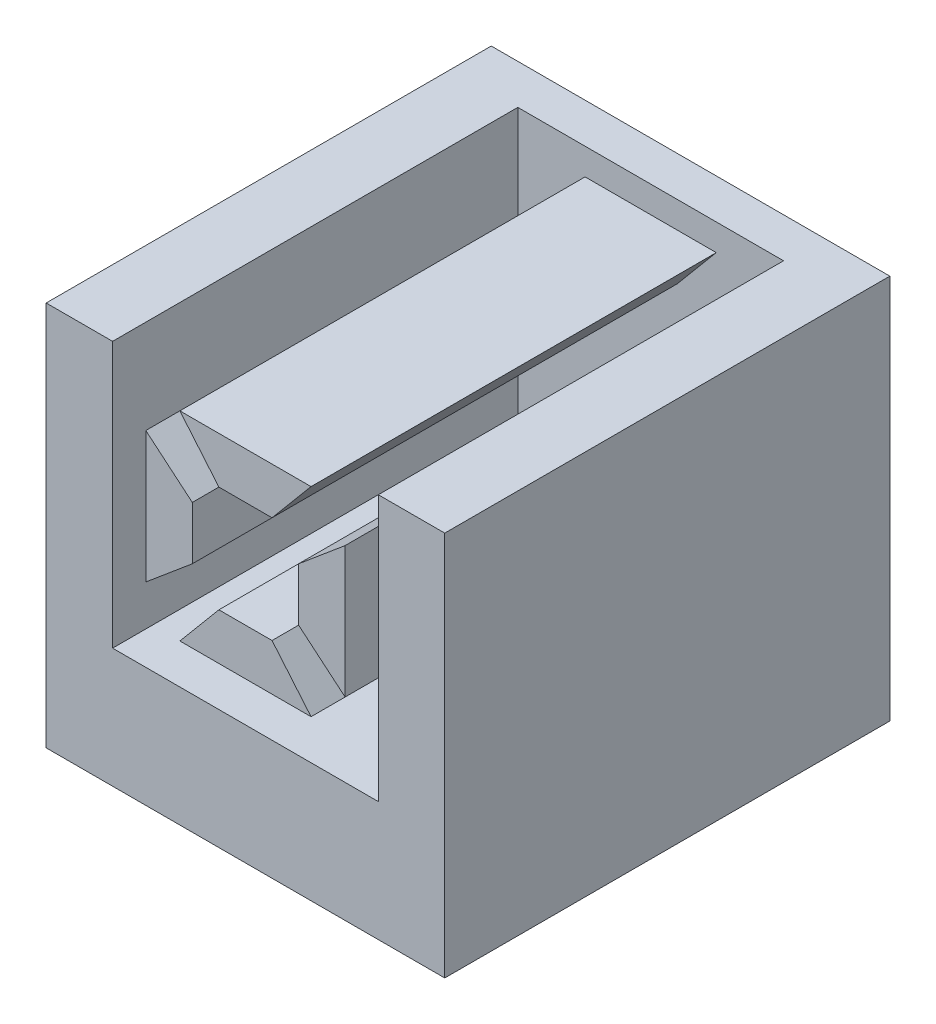
from build123d import *

# Parameters (mm, degrees)
BOSS_EXTRUDE2_DEPTH          = 8
BOSS_EXTRUDE2_DEPTH_BACK     = 1
SKETCH1_R                    = 2.5
CUT_EXTRUDE1_DEPTH           = 79.300702423
CUT_EXTRUDE1_DEPTH_BACK      = 79.300702423
SKETCH2_R                    = 2.5
SKETCH3_R                    = 3.25
CUT_EXTRUDE5_DEPTH           = 15
CUT_EXTRUDE5_DRAFT           = -0.0573
CUT_EXTRUDE5_PROFILE_2_DEPTH = 15
CUT_EXTRUDE5_PROFILE_2_DRAFT = -0.0573
SKETCH5_W                    = 4.5
SKETCH5_H                    = 6.5
BOSS_EXTRUDE3_DEPTH          = 14.5
SKETCH6_R                    = 4
CUT_EXTRUDE4_DEPTH           = 1.5
SKETCH12_W                   = 10.5
SKETCH12_H                   = 30
BOSS_EXTRUDE7_DEPTH          = 9
SKETCH15_W                   = 9
SKETCH15_H                   = 6.5
BOSS_EXTRUDE8_DEPTH          = 3.5
BOSS_EXTRUDE9_DEPTH          = 54
FILLET4_R                    = 5
SKETCH18_W                   = 9.873697418
SKETCH18_H                   = 6.5
BOSS_EXTRUDE11_DEPTH         = 0.5
SKETCH20_W                   = 4
SKETCH20_H                   = 17.5
BOSS_EXTRUDE12_DEPTH         = 18
BOSS_EXTRUDE13_DEPTH         = 11
BOSS_EXTRUDE13_DEPTH_BACK    = 4
SKETCH22_W                   = 17.5
SKETCH22_H                   = 4
SKETCH25_W                   = 2
SKETCH25_H                   = 17.5
BOSS_EXTRUDE14_DEPTH         = 41
SKETCH28_W                   = 41
SKETCH28_H                   = 45
BOSS_EXTRUDE15_DEPTH         = 2
SKETCH29_R                   = 1.75
CUT_EXTRUDE8_DEPTH           = 9
BOSS_EXTRUDE16_DEPTH         = 9
BOSS_EXTRUDE16_DEPTH_BACK    = 4
SKETCH30_W                   = 17.5
SKETCH30_H                   = 2
CUT_EXTRUDE9_DEPTH           = 9
SKETCH32_W                   = 13
SKETCH32_H                   = 4
BOSS_EXTRUDE17_DEPTH         = 23.5
SKETCH33_W                   = 0.5
SKETCH33_H                   = 17.5
BOSS_EXTRUDE18_DEPTH         = 20
SKETCH34_W                   = 4.5
SKETCH34_H                   = 25
SKETCH34_W_2                 = 15.5
SKETCH34_H_2                 = 4
SKETCH34_W_3                 = 9
BOSS_EXTRUDE19_DEPTH         = 26
SKETCH35_W                   = 9.873697418
SKETCH35_H                   = 0.5
BOSS_EXTRUDE20_DEPTH         = 47.5
BOSS_EXTRUDE21_DEPTH         = 47.5
SKETCH38_W                   = 0.419549816
SKETCH38_H                   = 18.5
CUT_EXTRUDE10_DEPTH          = 90.5
SKETCH39_W                   = 4
SKETCH39_H                   = 4
BOSS_EXTRUDE23_DEPTH         = 47.5
SKETCH46_W                   = 22.5
SKETCH46_H                   = 9
SKETCH46_W_2                 = 5
BOSS_EXTRUDE26_DEPTH         = 11.5
SKETCH47_W                   = 27.5
SKETCH47_H                   = 9
BOSS_EXTRUDE27_DEPTH         = 11
SKETCH48_W                   = 5
SKETCH48_H                   = 6.5
BOSS_EXTRUDE31_DEPTH         = 18.5
SKETCH50_R                   = 4
CUT_EXTRUDE11_DEPTH          = 1.5
SKETCH51_W                   = 9.626242636
SKETCH51_H                   = 9.125298808
BOSS_EXTRUDE32_DEPTH         = 1.5
BOSS_EXTRUDE35_DEPTH         = 47.5
SKETCH55_W                   = 9.873697418
SKETCH55_H                   = 0.5
CUT_EXTRUDE12_DEPTH          = 47.5
SKETCH56_W                   = 0.5
SKETCH56_H                   = 20
BOSS_EXTRUDE36_DEPTH         = 43.5
BOSS_EXTRUDE37_DEPTH         = 47.5
SKETCH58_W                   = 0.715052156
SKETCH58_H                   = 9.51279705
CUT_EXTRUDE13_DEPTH          = 4
CUT_EXTRUDE15_DEPTH          = 47.5
SKETCH60_W                   = 0.215052156
SKETCH60_H                   = 9.51279705
CUT_EXTRUDE16_DEPTH          = 47.5
CUT_EXTRUDE17_DEPTH          = 47.5
SKETCH62_W                   = 8
SKETCH62_H                   = 8
CUT_EXTRUDE18_DEPTH          = 47.5
SKETCH63_W                   = 13
SKETCH63_H                   = 4
CUT_EXTRUDE20_DEPTH          = 17
SKETCH64_W                   = 1
SKETCH64_H                   = 1.5
BOSS_EXTRUDE38_DEPTH         = 6.5
SKETCH65_W                   = 7
SKETCH65_H                   = 3
CUT_EXTRUDE21_DEPTH          = 1.5
BOSS_EXTRUDE39_START         = -2
BOSS_EXTRUDE39_DEPTH         = 2
CUT_EXTRUDE22_DEPTH          = 155
CUT_EXTRUDE24_DEPTH          = 100.318930723
CUT_EXTRUDE24_DEPTH_BACK     = 100.318930723
SKETCH71_R                   = 1.75
SKETCH71_R_2                 = 12.5
SKETCH71_W                   = 8.630690043
SKETCH71_H                   = 4
CUT_EXTRUDE25_DEPTH          = 10
CUT_EXTRUDE26_DEPTH          = 78.879714946
CUT_EXTRUDE26_DEPTH_BACK     = 78.879714946
SKETCH72_W                   = 11
SKETCH72_H                   = 4
SKETCH72_W_2                 = 23.5
SKETCH72_H_2                 = 9
SKETCH72_W_3                 = 9
SKETCH72_H_3                 = 16
SKETCH72_W_4                 = 7
SKETCH72_H_4                 = 1.5
BOSS_EXTRUDE40_DEPTH         = 3
CUT_EXTRUDE27_DEPTH          = 49
SKETCH75_W                   = 30
SKETCH75_H                   = 29
BOSS_EXTRUDE41_DEPTH         = 3
BOSS_EXTRUDE42_DEPTH         = 1


with BuildPart() as part:
    # Sketch1 → Boss-Extrude2 (new, two sides: drawn at the far end of the back side and taken through both)
    with BuildSketch(Plane(origin=(0, 0, 0), x_dir=(1, 0, 0), z_dir=(0, 1, 0)).offset(-BOSS_EXTRUDE2_DEPTH_BACK)):
        with BuildLine():
            Line((5, 0), (50, 0))
            ThreePointArc((50, 0), (53.535533906, 1.464466094), (55, 5))
            Line((55, 5), (55, 50))
            ThreePointArc((55, 50), (53.535533906, 53.535533906), (50, 55))
            Line((50, 55), (5, 55))
            ThreePointArc((5, 55), (1.464466094, 53.535533906), (0, 50))
            Line((0, 50), (0, 5))
            ThreePointArc((0, 5), (1.464466094, 1.464466094), (5, 0))
        make_face()
        with Locations(Location((7.5, 47.5, 0), (0, 0, 270))):
            Circle(SKETCH1_R, mode=Mode.SUBTRACT)
        with Locations(Location((47.5, 47.5, 0), (0, 0, 270))):
            Circle(SKETCH1_R, mode=Mode.SUBTRACT)
        with Locations(Location((47.5, 7.5, 0), (0, 0, 270))):
            Circle(SKETCH1_R, mode=Mode.SUBTRACT)
        with Locations(Location((7.5, 7.5, 0), (0, 0, 270))):
            Circle(SKETCH1_R, mode=Mode.SUBTRACT)
    extrude(amount=BOSS_EXTRUDE2_DEPTH + BOSS_EXTRUDE2_DEPTH_BACK)

    # Sketch2 → Cut-Extrude1 (cut, two sides: drawn at the far end of the back side and taken through both)
    with BuildSketch(Plane(origin=(0, 8, 0), x_dir=(1, 0, 0), z_dir=(0, 1, 0)).offset(-CUT_EXTRUDE1_DEPTH_BACK)):
        with BuildLine():
            Line((0, 50), (0, 27.5))
            Line((0, 27.5), (55, 27.5))
            Line((55, 27.5), (55, 50))
            ThreePointArc((55, 50), (53.535533906, 53.535533906), (50, 55))
            Line((50, 55), (5, 55))
            ThreePointArc((5, 55), (1.464466094, 53.535533906), (0, 50))
        make_face()
        with Locations((7.5, 47.5)):
            Circle(SKETCH2_R, mode=Mode.SUBTRACT)
        with Locations((47.5, 47.5)):
            Circle(SKETCH2_R, mode=Mode.SUBTRACT)
    extrude(amount=CUT_EXTRUDE1_DEPTH + CUT_EXTRUDE1_DEPTH_BACK, mode=Mode.SUBTRACT)


with BuildPart() as cut_extrude5_tool:
    # Sketch3 → Cut-Extrude5 (with draft: the straight prism first)
    with BuildSketch(Plane(origin=(0, 0, -27.5), x_dir=(-1, 0, 0), z_dir=(0, 0, -1))):
        with Locations((-37.5, 3.5)):
            Circle(SKETCH3_R)
    extrude(amount=-CUT_EXTRUDE5_DEPTH)
    # Cut-Extrude5: the draft: its side faces are tilted about the plane it starts from
    cut_extrude5_sides = [cut_extrude5_tool.faces().sort_by_distance(p)[0] for p in [
        (40.75, 3.5, -20),
    ]]
    draft(cut_extrude5_sides, Plane(origin=(0, 0, -27.5), x_dir=(-1, 0, 0), z_dir=(0, 0, -1)), CUT_EXTRUDE5_DRAFT)


with BuildPart() as part_1:
    add(part.part)

    # Cut-Extrude5: cut by cut_extrude5_tool
    add(cut_extrude5_tool.part, mode=Mode.SUBTRACT)


with BuildPart() as cut_extrude5_profile_2_tool:
    # Sketch3 → Cut-Extrude5 profile 2 (with draft: the straight prism first)
    with BuildSketch(Plane(origin=(0, 0, -27.5), x_dir=(-1, 0, 0), z_dir=(0, 0, -1))):
        with Locations((-17.5, 3.5)):
            Circle(SKETCH3_R)
    extrude(amount=-CUT_EXTRUDE5_PROFILE_2_DEPTH)
    # Cut-Extrude5 profile 2: the draft: its side faces are tilted about the plane it starts from
    cut_extrude5_profile_2_sides = [cut_extrude5_profile_2_tool.faces().sort_by_distance(p)[0] for p in [
        (20.75, 3.5, -20),
    ]]
    draft(cut_extrude5_profile_2_sides, Plane(origin=(0, 0, -27.5), x_dir=(-1, 0, 0), z_dir=(0, 0, -1)), CUT_EXTRUDE5_PROFILE_2_DRAFT)


with BuildPart() as part_2:
    add(part_1.part)

    # Cut-Extrude5 profile 2: cut by cut_extrude5_profile_2_tool
    add(cut_extrude5_profile_2_tool.part, mode=Mode.SUBTRACT)

    # Sketch5 → Boss-Extrude3 (add)
    with BuildSketch(Plane(origin=(0, 8, 0), x_dir=(1, 0, 0), z_dir=(0, 1, 0))):
        with Locations((25.25, 20.75)):
            Rectangle(SKETCH5_W, SKETCH5_H)
        with Locations((29.75, 20.75)):
            Rectangle(SKETCH5_W, SKETCH5_H)
    extrude(amount=BOSS_EXTRUDE3_DEPTH)

    # Sketch6 → Cut-Extrude4 (cut)
    with BuildSketch(Plane(origin=(0, 0, -24), x_dir=(-1, 0, 0), z_dir=(0, 0, -1))):
        with Locations((-27.5, 17)):
            Circle(SKETCH6_R)
    extrude(amount=-CUT_EXTRUDE4_DEPTH, mode=Mode.SUBTRACT)

    # Sketch12 → Boss-Extrude7 (add)
    with BuildSketch(Plane(origin=(0, 8, 0), x_dir=(1, 0, 0), z_dir=(0, 1, 0))):
        with Locations((32.75, -15)):
            Rectangle(SKETCH12_W, SKETCH12_H)
        with Locations((22.25, -15)):
            Rectangle(SKETCH12_W, SKETCH12_H)
    extrude(amount=-BOSS_EXTRUDE7_DEPTH)

    # Sketch15 → Boss-Extrude8 (add)
    with BuildSketch(Plane(origin=(0, 22.5, 0), x_dir=(1, 0, 0), z_dir=(0, 1, 0))):
        with Locations((27.5, 20.75)):
            Rectangle(SKETCH15_W, SKETCH15_H)
    extrude(amount=BOSS_EXTRUDE8_DEPTH)

    # Sketch11 → Boss-Extrude9 (add)
    with BuildSketch(Plane(origin=(0, 0, -24), x_dir=(-1, 0, 0), z_dir=(0, 0, -1))):
        Polygon((-32.436848709, 26), (-29.5, 22.5), (-29.5, 26), align=None)
        Polygon((-29.5, 22.5), (-27.5, 22.5), (-25.5, 22.5), (-25.5, 26), (-29.5, 26), align=None)
        Polygon((-25.5, 26), (-25.5, 22.5), (-22.563151291, 26), align=None)
    extrude(amount=-BOSS_EXTRUDE9_DEPTH)

    # Fillet4
    fillet4_edges = [part_2.edges().sort_by_distance(p)[0] for p in [
        (27.5, -1, 30),
    ]]
    fillet(fillet4_edges, radius=FILLET4_R)

    # Sketch18 → Boss-Extrude11 (add)
    with BuildSketch(Plane(origin=(0, 26, 0), x_dir=(1, 0, 0), z_dir=(0, 1, 0))):
        with Locations((27.5, 20.75)):
            Rectangle(SKETCH18_W, SKETCH18_H)
    extrude(amount=BOSS_EXTRUDE11_DEPTH)

    # Sketch20 → Boss-Extrude12 (add)
    with BuildSketch(Plane(origin=(0, 8, 0), x_dir=(1, 0, 0), z_dir=(0, 1, 0))):
        with Locations((14.5, 8.75)):
            Rectangle(SKETCH20_W, SKETCH20_H)
        with Locations((40.5, 8.75)):
            Rectangle(SKETCH20_W, SKETCH20_H)
    extrude(amount=BOSS_EXTRUDE12_DEPTH)

    # Sketch22 → Boss-Extrude13 (add, two sides: drawn at the far end of the back side and taken through both)
    with BuildSketch(Plane.ZY.offset(-12.5).offset(-BOSS_EXTRUDE13_DEPTH_BACK)):
        with Locations((-8.75, 26)):
            Rectangle(SKETCH22_W, SKETCH22_H)
    extrude(amount=BOSS_EXTRUDE13_DEPTH + BOSS_EXTRUDE13_DEPTH_BACK)

    # Sketch25 → Boss-Extrude14 (add)
    with BuildSketch(Plane(origin=(0, 28, 0), x_dir=(1, 0, 0), z_dir=(0, 1, 0))):
        with Locations((2.5, 8.75)):
            Rectangle(SKETCH25_W, SKETCH25_H)
    extrude(amount=BOSS_EXTRUDE14_DEPTH)

    # Sketch28 → Boss-Extrude15 (add)
    with BuildSketch(Plane.ZY.offset(-1.5)):
        with Locations((-20.5, 46.5)):
            Rectangle(SKETCH28_W, SKETCH28_H)
    extrude(amount=-BOSS_EXTRUDE15_DEPTH)

    # Sketch29 → Cut-Extrude8 (cut)
    with BuildSketch(Plane.ZY.offset(-1.5)):
        with Locations((-36, 33)):
            Circle(SKETCH29_R)
        with Locations((-5, 64)):
            Circle(SKETCH29_R)
        with Locations((-5, 33)):
            Circle(SKETCH29_R)
        with Locations((-36, 64)):
            Circle(SKETCH29_R)
    extrude(amount=-CUT_EXTRUDE8_DEPTH, mode=Mode.SUBTRACT)

    # Sketch30 → Boss-Extrude16 (add, two sides: drawn at the far end of the back side and taken through both)
    with BuildSketch(Plane(origin=(42.5, 0, 0), x_dir=(0, 0, -1), z_dir=(1, 0, 0)).offset(-BOSS_EXTRUDE16_DEPTH_BACK)):
        with Locations((8.75, 25)):
            Rectangle(SKETCH30_W, SKETCH30_H)
        with Locations((8.75, 27)):
            Rectangle(SKETCH30_W, SKETCH30_H)
    extrude(amount=BOSS_EXTRUDE16_DEPTH + BOSS_EXTRUDE16_DEPTH_BACK)

    # Sketch31 → Cut-Extrude9 (cut)
    with BuildSketch(Plane(origin=(3.5, 0, 0), x_dir=(0, 0, -1), z_dir=(1, 0, 0))):
        with BuildLine():
            ThreePointArc((30.5, 47), (27.571067812, 54.071067812), (20.5, 57))
            Line((20.5, 57), (20.5, 47))
            Line((20.5, 47), (30.5, 47))
        make_face()
        with BuildLine():
            Line((20.5, 47), (20.5, 57))
            ThreePointArc((20.5, 57), (13.428932188, 39.928932188), (30.5, 47))
            Line((30.5, 47), (20.5, 47))
        make_face()
    extrude(amount=-CUT_EXTRUDE9_DEPTH, mode=Mode.SUBTRACT)

    # Sketch32 → Boss-Extrude17 (add)
    with BuildSketch(Plane(origin=(0, 0, -17.5), x_dir=(-1, 0, 0), z_dir=(0, 0, -1))):
        with Locations((-10, 26)):
            Rectangle(SKETCH32_W, SKETCH32_H)
    extrude(amount=BOSS_EXTRUDE17_DEPTH)

    # Sketch33 → Boss-Extrude18 (add)
    with BuildSketch(Plane(origin=(0, 8, 0), x_dir=(1, 0, 0), z_dir=(0, 1, 0))):
        with Locations((38.25, 8.75)):
            Rectangle(SKETCH33_W, SKETCH33_H)
        with Locations((16.75, 8.75)):
            Rectangle(SKETCH33_W, SKETCH33_H)
    extrude(amount=BOSS_EXTRUDE18_DEPTH)

    # Sketch34 → Boss-Extrude19 (add)
    with BuildSketch(Plane.XY):
        with Locations((14.75, 11.5)):
            Rectangle(SKETCH34_W, SKETCH34_H)
        with Locations((9.25, 26)):
            Rectangle(SKETCH34_W_2, SKETCH34_H_2)
        Polygon((42.5, 24), (42.5, 28), (38, 28), (38, 8), (38, -1), (42.5, -1), (42.5, 8), align=None)
        with Locations((47, 26)):
            Rectangle(SKETCH34_W_3, SKETCH34_H_2)
    extrude(amount=BOSS_EXTRUDE19_DEPTH)

    # Sketch35 → Boss-Extrude20 (add)
    with BuildSketch(Plane.XY.offset(-17.5)):
        with Locations((27.5, 26.25)):
            Rectangle(SKETCH35_W, SKETCH35_H)
    extrude(amount=BOSS_EXTRUDE20_DEPTH)

    # Sketch37 → Boss-Extrude21 (add)
    with BuildSketch(Plane.XY.offset(-17.5)):
        Polygon((23, 8), (25.5, 8), (25.5, 12), (23, 9.020616019), align=None)
        Polygon((25.5, 8), (27.5, 8), (29.5, 8), (29.5, 12), (25.5, 12), align=None)
        Polygon((29.5, 12), (29.5, 8), (32, 8), (32, 9.020616019), align=None)
        Polygon((29.5, 8), (27.5, 8), (25.5, 8), (23, 8), (23, 9.020616019), (21.863844179, 7.666598237), (33.136155821, 7.666598237), (32, 9.020616019), (32, 8), align=None)
    extrude(amount=BOSS_EXTRUDE21_DEPTH)

    # Sketch38 → Cut-Extrude10 (cut)
    with BuildSketch(Plane.XY.offset(30)):
        with Locations((22.353376383, 17.25)):
            Rectangle(SKETCH38_W, SKETCH38_H)
        with Locations((32.646623617, 17.25)):
            Rectangle(SKETCH38_W, SKETCH38_H)
    extrude(amount=-CUT_EXTRUDE10_DEPTH, mode=Mode.SUBTRACT)

    # Sketch39 → Boss-Extrude23 (add)
    with BuildSketch(Plane.XY.offset(30)):
        Polygon((21, 19.25), (17.715052156, 22.006398525), (17, 22.006398525), (17, 19.25), align=None)
        with Locations((19, 17.25)):
            Rectangle(SKETCH39_W, SKETCH39_H)
        Polygon((17.715052156, 12.493601475), (21, 15.25), (17, 15.25), (17, 12.493601475), align=None)
        Polygon((37.284947844, 12.493601475), (38, 12.493601475), (38, 15.25), (34, 15.25), align=None)
        Polygon((38, 17.25), (38, 19.25), (34, 19.25), (34, 15.25), (38, 15.25), align=None)
        Polygon((38, 19.25), (38, 22.006398525), (37.284947844, 22.006398525), (34, 19.25), align=None)
    extrude(amount=-BOSS_EXTRUDE23_DEPTH)

    # Sketch46 → Boss-Extrude26 (add)
    with BuildSketch(Plane.ZY):
        with Locations((-16.25, 3.5)):
            Rectangle(SKETCH46_W, SKETCH46_H)
        with Locations((-2.5, 3.5)):
            Rectangle(SKETCH46_W_2, SKETCH46_H)
    extrude(amount=-BOSS_EXTRUDE26_DEPTH)

    # Sketch47 → Boss-Extrude27 (add)
    with BuildSketch(Plane.ZY):
        with Locations((-13.75, 3.5)):
            Rectangle(SKETCH47_W, SKETCH47_H)
    extrude(amount=BOSS_EXTRUDE27_DEPTH)

    # Sketch48 → Boss-Extrude31 (add)
    with BuildSketch(Plane(origin=(0, 8, 0), x_dir=(1, 0, 0), z_dir=(0, 1, 0))):
        Polygon((42.5, 17.5), (42.5, 24), (32, 24), (32, 17.5), (32.436848709, 17.5), (38, 17.5), align=None)
        with Locations((45, 20.75)):
            Rectangle(SKETCH48_W, SKETCH48_H)
        Polygon((12.5, 24), (12.5, 17.5), (17, 17.5), (22.563151291, 17.5), (23, 17.5), (23, 24), align=None)
        with Locations((10, 20.75)):
            Rectangle(SKETCH48_W, SKETCH48_H)
    extrude(amount=BOSS_EXTRUDE31_DEPTH)

    # Sketch50 → Cut-Extrude11 (cut)
    with BuildSketch(Plane(origin=(0, 0, -24), x_dir=(-1, 0, 0), z_dir=(0, 0, -1))):
        with Locations((-17.5, 17)):
            Circle(SKETCH50_R)
        with Locations((-37.5, 17)):
            Circle(SKETCH50_R)
    extrude(amount=-CUT_EXTRUDE11_DEPTH, mode=Mode.SUBTRACT)

    # Sketch51 → Boss-Extrude32 (add)
    with BuildSketch(Plane(origin=(0, 0, -24), x_dir=(-1, 0, 0), z_dir=(0, 0, -1))):
        with Locations((-27.646184708, 17.114099589)):
            Rectangle(SKETCH51_W, SKETCH51_H)
    extrude(amount=-BOSS_EXTRUDE32_DEPTH)

    # Sketch54 → Boss-Extrude35 (add)
    with BuildSketch(Plane.XY.offset(-17.5)):
        Polygon((29.5, 22.5), (27.5, 22.5), (27.5, 14.5), (31.5, 14.5), (31.5, 22.5), align=None)
        Polygon((27.5, 14.5), (27.5, 22.5), (25.5, 22.5), (23.5, 22.5), (23.5, 14.5), align=None)
    extrude(amount=BOSS_EXTRUDE35_DEPTH)

    # Sketch55 → Cut-Extrude12 (cut)
    with BuildSketch(Plane.XY.offset(30)):
        with Locations((27.5, 26.25)):
            Rectangle(SKETCH55_W, SKETCH55_H)
    extrude(amount=-CUT_EXTRUDE12_DEPTH, mode=Mode.SUBTRACT)

    # Sketch56 → Boss-Extrude36 (add)
    with BuildSketch(Plane.XY.offset(26)):
        with Locations((37.75, 18)):
            Rectangle(SKETCH56_W, SKETCH56_H)
        with Locations((17.25, 18)):
            Rectangle(SKETCH56_W, SKETCH56_H)
    extrude(amount=-BOSS_EXTRUDE36_DEPTH)

    # Sketch57 → Boss-Extrude37 (add)
    with BuildSketch(Plane.XY.offset(30)):
        Polygon((35, 23.436848709), (31.5, 20.5), (31.5, 20.428787517), (35, 20.428787517), align=None)
        Polygon((35, 20.428787517), (31.5, 20.428787517), (31.5, 18.5), (35, 18.5), (35, 18.535606241), align=None)
        Polygon((35, 18.5), (31.5, 18.5), (31.5, 16.5), (35, 16.5), (35, 18.464393759), align=None)
        Polygon((35, 16.5), (31.5, 16.5), (35, 13.563151291), align=None)
        Polygon((32.436848709, 11), (29.5, 14.5), (25.5, 14.5), (22.563151291, 11), align=None)
        Polygon((20, 16.5), (23.5, 16.5), (23.5, 18.5), (23.5, 20.5), (20, 23.436848709), (20, 18.535606241), (20, 18.464393759), align=None)
        Polygon((20, 13.563151291), (23.5, 16.5), (20, 16.5), align=None)
    extrude(amount=-BOSS_EXTRUDE37_DEPTH)

    # Sketch58 → Cut-Extrude13 (cut)
    with BuildSketch(Plane.XY.offset(30)):
        with Locations((37.642473922, 17.25)):
            Rectangle(SKETCH58_W, SKETCH58_H)
        with Locations((17.357526078, 17.25)):
            Rectangle(SKETCH58_W, SKETCH58_H)
    extrude(amount=-CUT_EXTRUDE13_DEPTH, mode=Mode.SUBTRACT)

    # Sketch59 → Cut-Extrude15 (cut)
    with BuildSketch(Plane.XY.offset(30)):
        Polygon((37.284947844, 22.006398525), (35, 20.089099631), (35, 14.410900369), (37.284947844, 12.493601475), align=None)
        Polygon((17.715052156, 22.006398525), (20, 20.089099631), (20, 14.410900369), (17.715052156, 12.493601475), align=None)
    extrude(amount=-CUT_EXTRUDE15_DEPTH, mode=Mode.SUBTRACT)

    # Sketch60 → Cut-Extrude16 (cut)
    with BuildSketch(Plane.XY.offset(26)):
        with Locations((37.392473922, 17.25)):
            Rectangle(SKETCH60_W, SKETCH60_H)
        with Locations((17.607526078, 17.25)):
            Rectangle(SKETCH60_W, SKETCH60_H)
    extrude(amount=-CUT_EXTRUDE16_DEPTH, mode=Mode.SUBTRACT)

    # Sketch61 → Cut-Extrude17 (cut)
    with BuildSketch(Plane.XY.offset(30)):
        Polygon((32.436848709, 8), (22.563151291, 8), (22.563151291, 8.5), (24.660900369, 11), (30.339099631, 11), (32.436848709, 8.5), align=None)
    extrude(amount=-CUT_EXTRUDE17_DEPTH, mode=Mode.SUBTRACT)

    # Sketch62 → Cut-Extrude18 (cut)
    with BuildSketch(Plane.XY.offset(30)):
        with Locations((27.5, 18.5)):
            Rectangle(SKETCH62_W, SKETCH62_H)
    extrude(amount=-CUT_EXTRUDE18_DEPTH, mode=Mode.SUBTRACT)

    # Sketch63 → Cut-Extrude20 (cut)
    with BuildSketch(Plane(origin=(0, 0, -41), x_dir=(-1, 0, 0), z_dir=(0, 0, -1))):
        with Locations((-10, 26)):
            Rectangle(SKETCH63_W, SKETCH63_H)
    extrude(amount=-CUT_EXTRUDE20_DEPTH, mode=Mode.SUBTRACT)

    # Sketch64 → Boss-Extrude38 (add)
    with BuildSketch(Plane(origin=(0, 0, -17.5), x_dir=(-1, 0, 0), z_dir=(0, 0, -1))):
        with Locations((-17, 27.25)):
            Rectangle(SKETCH64_W, SKETCH64_H)
    extrude(amount=BOSS_EXTRUDE38_DEPTH)

    # Sketch65 → Cut-Extrude21 (cut)
    with BuildSketch(Plane(origin=(0, 28, 0), x_dir=(1, 0, 0), z_dir=(0, 1, 0))):
        with Locations((48, 16)):
            Rectangle(SKETCH65_W, SKETCH65_H)
    extrude(amount=-CUT_EXTRUDE21_DEPTH, mode=Mode.SUBTRACT)

    # Sketch66 → Boss-Extrude39 (add)
    with BuildSketch(Plane.ZY.offset(-1.5).offset(BOSS_EXTRUDE39_START)):
        with BuildLine():
            ThreePointArc((-30.5, 47), (-20.5, 37), (-10.5, 47))
            Line((-10.5, 47), (-30.5, 47))
        make_face()
        with BuildLine():
            Line((-30.5, 47), (-10.5, 47))
            ThreePointArc((-10.5, 47), (-20.5, 57), (-30.5, 47))
        make_face()
    extrude(amount=BOSS_EXTRUDE39_DEPTH)

    # Sketch67 → Cut-Extrude22 (cut)
    with BuildSketch(Plane.ZY.offset(-1.5)):
        with BuildLine():
            ThreePointArc((-33, 48.5), (-29.338834765, 39.661165235), (-20.5, 36))
            Line((-20.5, 36), (-20.5, 48.5))
            Line((-20.5, 48.5), (-33, 48.5))
        make_face()
        with BuildLine():
            Line((-20.5, 48.5), (-20.5, 36))
            ThreePointArc((-20.5, 36), (-11.661165235, 39.661165235), (-8, 48.5))
            Line((-8, 48.5), (-20.5, 48.5))
        make_face()
        with BuildLine():
            Line((-33, 48.5), (-20.5, 48.5))
            Line((-20.5, 48.5), (-20.5, 61))
            ThreePointArc((-20.5, 61), (-29.338834765, 57.338834765), (-33, 48.5))
        make_face()
        with BuildLine():
            Line((-20.5, 61), (-20.5, 48.5))
            Line((-20.5, 48.5), (-8, 48.5))
            ThreePointArc((-8, 48.5), (-11.661165235, 57.338834765), (-20.5, 61))
        make_face()
    extrude(amount=-CUT_EXTRUDE22_DEPTH, mode=Mode.SUBTRACT)

    # Sketch70 → Cut-Extrude24 (cut, two sides: drawn at the far end of the back side and taken through both)
    with BuildSketch(Plane(origin=(47.5, 0, 0), x_dir=(0, 0, -1), z_dir=(1, 0, 0)).offset(-CUT_EXTRUDE24_DEPTH_BACK)):
        Polygon((24, 26.5), (24, 8), (32.338984554, 8), (32.338984554, 35.599062225), (17.5, 35.599062225), (17.5, 26.5), align=None)
        Polygon((24, 8), (17.5, 8), (17.5, -11.953759578), (33.273947099, -11.953759578), (33.273947099, 8), (32.338984554, 8), align=None)
        Polygon((17.5, 24), (17.5, 8), (24, 8), (24, 26.5), (17.5, 26.5), align=None)
    extrude(amount=CUT_EXTRUDE24_DEPTH + CUT_EXTRUDE24_DEPTH_BACK, mode=Mode.SUBTRACT)


with BuildPart() as cut_extrude24_piece_1:
    # of the separate pieces the step leaves, piece 1, a body of its own (cut_extrude24_pieces)
    add(part_2.part.solids().sort_by_distance((38, 4, 30))[0])

    # Sketch71 → Cut-Extrude25 (cut)
    # profile 1 of 4: a face of its own
    with BuildSketch(Plane(origin=(3.5, 0, 0), x_dir=(0, 0, -1), z_dir=(1, 0, 0))):
        Polygon((0, 98.329177842), (0, 69), (41, 69), (41, 28), (61.289535751, 28), (61.289535751, 98.329177842), align=None)
    # profile 2 of 4: a face of its own
    with BuildSketch(Plane(origin=(3.5, 0, 0), x_dir=(0, 0, -1), z_dir=(1, 0, 0))):
        Polygon((0, 69), (0, 28), (17.5, 28), (17.5, 35.599062225), (32.338984554, 35.599062225), (32.338984554, 28), (32.369309957, 28), (41, 28), (41, 69), align=None)
        with Locations((5, 33)):
            Circle(SKETCH71_R, mode=Mode.SUBTRACT)
        with Locations((36, 33)):
            Circle(SKETCH71_R, mode=Mode.SUBTRACT)
        with Locations((20.5, 48.5)):
            Circle(SKETCH71_R_2, mode=Mode.SUBTRACT)
        with Locations((5, 64)):
            Circle(SKETCH71_R, mode=Mode.SUBTRACT)
        with Locations((36, 64)):
            Circle(SKETCH71_R, mode=Mode.SUBTRACT)
    # profile 3 of 4: a face of its own
    with BuildSketch(Plane(origin=(3.5, 0, 0), x_dir=(0, 0, -1), z_dir=(1, 0, 0))):
        Polygon((61.289535751, 28), (41, 28), (41, 24), (32.369309957, 24), (32.369309957, 8.193802702), (79.936666515, 8.193802702), (79.936666515, 28), align=None)
    # profile 4 of 4: a face of its own
    with BuildSketch(Plane(origin=(3.5, 0, 0), x_dir=(0, 0, -1), z_dir=(1, 0, 0))):
        with Locations((36.684654978, 26)):
            Rectangle(SKETCH71_W, SKETCH71_H)
    extrude(amount=-CUT_EXTRUDE25_DEPTH, mode=Mode.SUBTRACT)


with BuildPart() as cut_extrude24_piece_2:
    # of the separate pieces the step leaves, piece 2, a body of its own (cut_extrude24_pieces)
    add(part_2.part.solids().sort_by_distance((23.5, 20.5, 30))[0])



with BuildPart() as cut_extrude24_piece_3:
    # of the separate pieces the step leaves, piece 3, a body of its own (cut_extrude24_pieces)
    add(part_2.part.solids().sort_by_distance((31.5, 16.5, 30))[0])


with BuildPart() as cut_extrude24_piece_4:
    # of the separate pieces the step leaves, piece 4, a body of its own (cut_extrude24_pieces)
    add(part_2.part.solids().sort_by_distance((32.436848709, 26, -17.5))[0])


with BuildPart() as cut_extrude24_piece_5:
    # of the separate pieces the step leaves, piece 5, a body of its own (cut_extrude24_pieces)
    add(part_2.part.solids().sort_by_distance((32.436848709, 11, 30))[0])


with BuildPart() as cut_extrude25_piece_1:
    # of the separate pieces the step leaves, piece 1, a body of its own (cut_extrude25_pieces)
    add(cut_extrude24_piece_1.part.solids().sort_by_distance((38, 4, 30))[0])


with BuildPart() as cut_extrude25_piece_2:
    # of the separate pieces the step leaves, piece 2, a body of its own (cut_extrude25_pieces)
    add(cut_extrude24_piece_1.part.solids().sort_by_distance((3.5, 28, -32.369309957))[0])


with BuildPart() as cut_extrude26_tool:
    # Sketch72 → Cut-Extrude26 (new, two sides: drawn at the far end of the back side and taken through both)
    with BuildSketch(Plane(origin=(0, 0, -17.5), x_dir=(-1, 0, 0), z_dir=(0, 0, -1)).offset(-CUT_EXTRUDE26_DEPTH_BACK)):
        Polygon((-1.5, 24), (-12.5, 24), (-12.5, 8), (11, 8), (11, 28), (-1.5, 28), align=None)
        with Locations((-7, 26)):
            Rectangle(SKETCH72_W, SKETCH72_H)
        with Locations((-0.75, 3.5)):
            Rectangle(SKETCH72_W_2, SKETCH72_H_2)
        with Locations((-47, 16)):
            Rectangle(SKETCH72_W_3, SKETCH72_H_3)
        Polygon((-51.5, 24), (-42.5, 24), (-42.5, 28), (-44.5, 28), (-44.5, 26.5), (-51.5, 26.5), align=None)
        Polygon((-55, 8), (-51.5, 8), (-51.5, 24), (-51.5, 26.5), (-51.5, 28), (-55, 28), align=None)
        Polygon((-55, -1), (-42.5, -1), (-42.5, 8), (-51.5, 8), (-55, 8), align=None)
        with Locations((-48, 27.25)):
            Rectangle(SKETCH72_W_4, SKETCH72_H_4)
    extrude(amount=CUT_EXTRUDE26_DEPTH + CUT_EXTRUDE26_DEPTH_BACK)


with BuildPart() as cut_extrude25_piece_1_1:
    add(cut_extrude25_piece_1.part)

    # Cut-Extrude26: cut by cut_extrude26_tool
    add(cut_extrude26_tool.part, mode=Mode.SUBTRACT)


with BuildPart() as cut_extrude25_piece_2_1:
    add(cut_extrude25_piece_2.part)

    # Cut-Extrude26: cut by cut_extrude26_tool
    add(cut_extrude26_tool.part, mode=Mode.SUBTRACT)


with BuildPart() as cut_extrude24_piece_2_1:
    add(cut_extrude24_piece_2.part)

    add(cut_extrude24_piece_3.part)  # Boss-Extrude40 merges Cut-Extrude24 piece 3

    add(cut_extrude24_piece_4.part)  # Boss-Extrude40 merges Cut-Extrude24 piece 4

    add(cut_extrude24_piece_5.part)  # Boss-Extrude40 merges Cut-Extrude24 piece 5

    add(cut_extrude25_piece_1_1.part)  # Boss-Extrude40 merges Cut-Extrude25 piece 1
    # Sketch73 → Boss-Extrude40 (add)
    with BuildSketch(Plane(origin=(0, 0, -17.5), x_dir=(-1, 0, 0), z_dir=(0, 0, -1))):
        Polygon((-42.5, 13.5), (-12.5, 13.5), (-12.5, 28), (-27.5, 28), align=None)
    extrude(amount=-BOSS_EXTRUDE40_DEPTH)

    # Sketch74 → Cut-Extrude27 (cut)
    with BuildSketch(Plane(origin=(0, 28, 0), x_dir=(1, 0, 0), z_dir=(0, 1, 0))):
        Polygon((142.438868127, -16), (42.5, -16), (12.5, -16), (12.5, -26), (42.5, -26), (42.5, -16), (42.5, -35.398740347), (12.5, -35.398740347), (12.5, -16), (12.5, 83.938868127), (-109.356799608, -74.497333037), (20.582068519, -174.436201164), align=None)
    extrude(amount=-CUT_EXTRUDE27_DEPTH, mode=Mode.SUBTRACT)


with BuildPart() as cut_extrude27_kept_piece:
    # of the separate pieces the step leaves, the one the design keeps (cut_extrude27_pieces_kept)
    add(cut_extrude24_piece_2_1.part.solids().sort_by_distance((17.5, 8, -17.5))[0])

    # Sketch75 → Boss-Extrude41 (add)
    with BuildSketch(Plane(origin=(0, 0, -17.5), x_dir=(-1, 0, 0), z_dir=(0, 0, -1))):
        with Locations((-27.5, 13.5)):
            Rectangle(SKETCH75_W, SKETCH75_H)
    extrude(amount=-BOSS_EXTRUDE41_DEPTH)

    # Sketch76 → Boss-Extrude42 (add)
    with BuildSketch(Plane(origin=(0, 0, -17.5), x_dir=(-1, 0, 0), z_dir=(0, 0, -1))):
        with BuildLine():
            ThreePointArc((-29.748273901, 11.326668562), (-27.5, 10.373003826), (-25.251726099, 11.326668562))
            Line((-25.251726099, 11.326668562), (-27.5, 13.5))
            Line((-27.5, 13.5), (-29.748273901, 11.326668562))
        make_face()
        with BuildLine():
            Line((-27.5, 13.5), (-25.251726099, 11.326668562))
            ThreePointArc((-25.251726099, 11.326668562), (-24.600995951, 12.327873474), (-24.373003826, 13.5))
            ThreePointArc((-24.373003826, 13.5), (-24.600995951, 14.672126526), (-25.251726099, 15.673331438))
            Line((-25.251726099, 15.673331438), (-27.5, 13.5))
        make_face()
        with BuildLine():
            Line((-29.748273901, 11.326668562), (-27.5, 13.5))
            Line((-27.5, 13.5), (-29.748273901, 15.673331438))
            ThreePointArc((-29.748273901, 15.673331438), (-30.626996174, 13.5), (-29.748273901, 11.326668562))
        make_face()
        with BuildLine():
            Line((-29.748273901, 15.673331438), (-27.5, 13.5))
            Line((-27.5, 13.5), (-25.251726099, 15.673331438))
            ThreePointArc((-25.251726099, 15.673331438), (-27.5, 16.626996174), (-29.748273901, 15.673331438))
        make_face()
    extrude(amount=BOSS_EXTRUDE42_DEPTH)


solid = cut_extrude27_kept_piece.part
